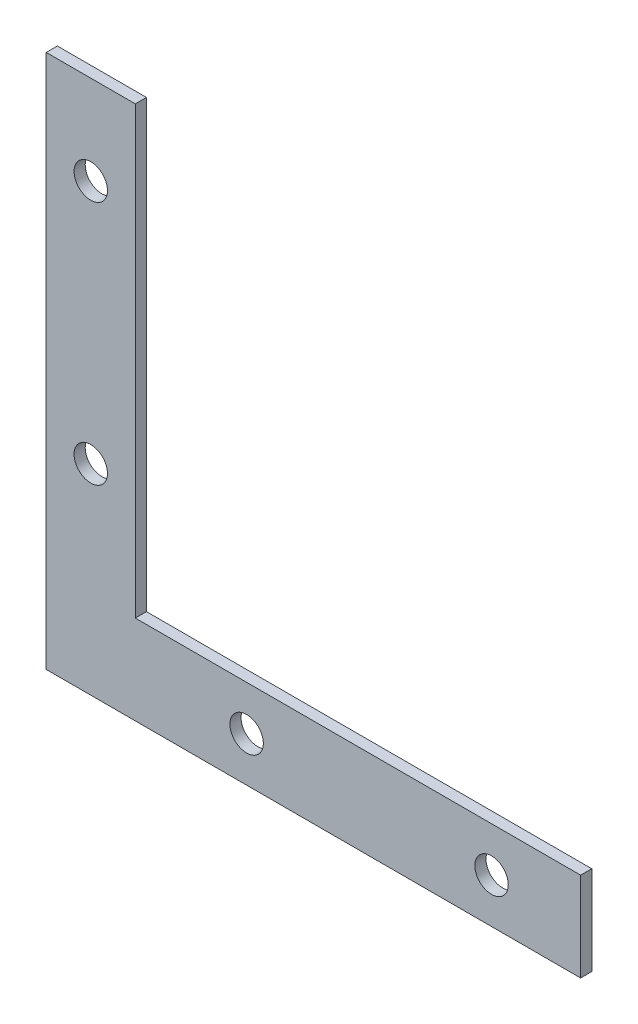
from build123d import *

# Parameters (mm, degrees)
SKETCH1_R           = 2.38125
BOSS_EXTRUDE1_DEPTH = 1.5875


with BuildPart() as part:
    # Sketch1 → Boss-Extrude1 (new body)
    with BuildSketch(Plane.XY):
        Polygon((0, 0), (0, 76.2), (12.7, 76.2), (12.7, 12.7), (76.2, 12.7), (76.2, 0), align=None)
        with Locations((63.5, 6.35)):
            Circle(SKETCH1_R, mode=Mode.SUBTRACT)
        with Locations((28.575, 6.35)):
            Circle(SKETCH1_R, mode=Mode.SUBTRACT)
        with Locations(Location((6.35, 63.5, 0), (0, 0, 180))):
            Circle(SKETCH1_R, mode=Mode.SUBTRACT)
        with Locations(Location((6.35, 28.575, 0), (0, 0, 180))):
            Circle(SKETCH1_R, mode=Mode.SUBTRACT)
    extrude(amount=BOSS_EXTRUDE1_DEPTH)


solid = part.part
